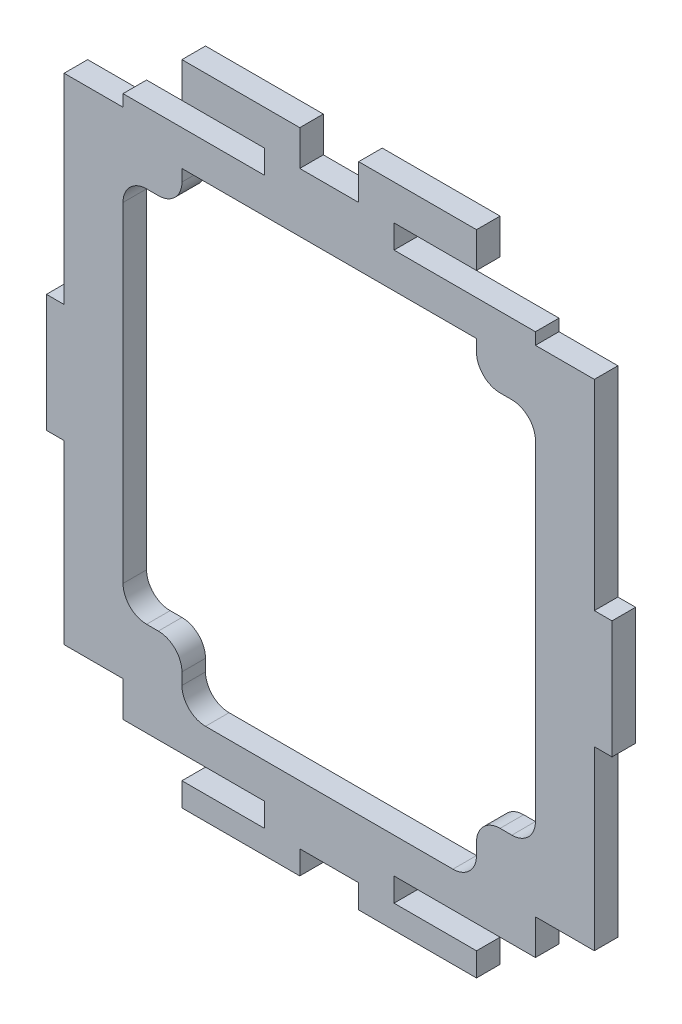
from build123d import *

# Parameters (mm, degrees)
EXTRUDE_1_DEPTH = 2


with BuildPart() as part:
    # Model → 凸台-拉伸1 (new body)
    with BuildSketch(Plane.XY):
        Polygon((1228.50953615, 484.721569843), (1228.50953615, 467.721569843), (1227.00953615, 467.721569843), (1227.00953615, 457.721569843), (1228.50953615, 457.721569843), (1228.50953615, 442.721569843), (1233.50953615, 442.721569843), (1233.50953615, 439.721569843), (1245.50953615, 439.721569843), (1245.50953615, 437.721569843), (1238.50953615, 437.721569843), (1238.50953615, 435.721569843), (1248.50953615, 435.721569843), (1248.50953615, 437.721569843), (1253.50953615, 437.721569843), (1253.50953615, 435.721569843), (1263.50953615, 435.721569843), (1263.50953615, 437.721569843), (1256.50953615, 437.721569843), (1256.50953615, 439.721569843), (1268.50953615, 439.721569843), (1268.50953615, 442.721569843), (1273.50953615, 442.721569843), (1273.50953615, 457.721569843), (1275.00953615, 457.721569843), (1275.00953615, 467.721569843), (1273.50953615, 467.721569843), (1273.50953615, 484.721569843), (1268.50953615, 484.721569843), (1268.50953615, 485.721569843), (1256.50953615, 485.721569843), (1256.50953615, 487.721569843), (1263.50953615, 487.721569843), (1263.50953615, 490.721569843), (1253.50953615, 490.721569843), (1253.50953615, 487.721569843), (1248.50953615, 487.721569843), (1248.50953615, 490.721569843), (1238.50953615, 490.721569843), (1238.50953615, 487.721569843), (1245.50953615, 487.721569843), (1245.50953615, 485.721569843), (1233.50953615, 485.721569843), (1233.50953615, 484.721569843), align=None)
        with BuildLine():
            Line((1235.50953615, 479.721569843), (1236.50953615, 479.721569843))
            ThreePointArc((1236.50953615, 479.721569843), (1237.923749713, 480.307356281), (1238.50953615, 481.721569843))
            Line((1238.50953615, 481.721569843), (1238.50953615, 482.721569843))
            Line((1238.50953615, 482.721569843), (1263.50953615, 482.721569843))
            Line((1263.50953615, 482.721569843), (1263.50953615, 481.721569843))
            ThreePointArc((1263.50953615, 481.721569843), (1264.095322588, 480.307356281), (1265.50953615, 479.721569843))
            Line((1265.50953615, 479.721569843), (1266.50953615, 479.721569843))
            ThreePointArc((1266.50953615, 479.721569843), (1267.923749713, 479.135783405), (1268.50953615, 477.721569843))
            Line((1268.50953615, 477.721569843), (1268.50953615, 449.721569843))
            ThreePointArc((1268.50953615, 449.721569843), (1267.923749713, 448.307356281), (1266.50953615, 447.721569843))
            Line((1266.50953615, 447.721569843), (1265.50953615, 447.721569843))
            ThreePointArc((1265.50953615, 447.721569843), (1264.095322588, 447.135783405), (1263.50953615, 445.721569843))
            Line((1263.50953615, 445.721569843), (1263.50953615, 444.721569843))
            ThreePointArc((1263.50953615, 444.721569843), (1262.923749713, 443.307356281), (1261.50953615, 442.721569843))
            Line((1261.50953615, 442.721569843), (1240.50953615, 442.721569843))
            ThreePointArc((1240.50953615, 442.721569843), (1239.095322588, 443.307356281), (1238.50953615, 444.721569843))
            Line((1238.50953615, 444.721569843), (1238.50953615, 445.721569843))
            ThreePointArc((1238.50953615, 445.721569843), (1237.923749713, 447.135783405), (1236.50953615, 447.721569843))
            Line((1236.50953615, 447.721569843), (1235.50953615, 447.721569843))
            ThreePointArc((1235.50953615, 447.721569843), (1234.095322588, 448.307356281), (1233.50953615, 449.721569843))
            Line((1233.50953615, 449.721569843), (1233.50953615, 477.721569843))
            ThreePointArc((1233.50953615, 477.721569843), (1234.095322588, 479.135783405), (1235.50953615, 479.721569843))
        make_face(mode=Mode.SUBTRACT)
    extrude(amount=EXTRUDE_1_DEPTH)


solid = part.part
